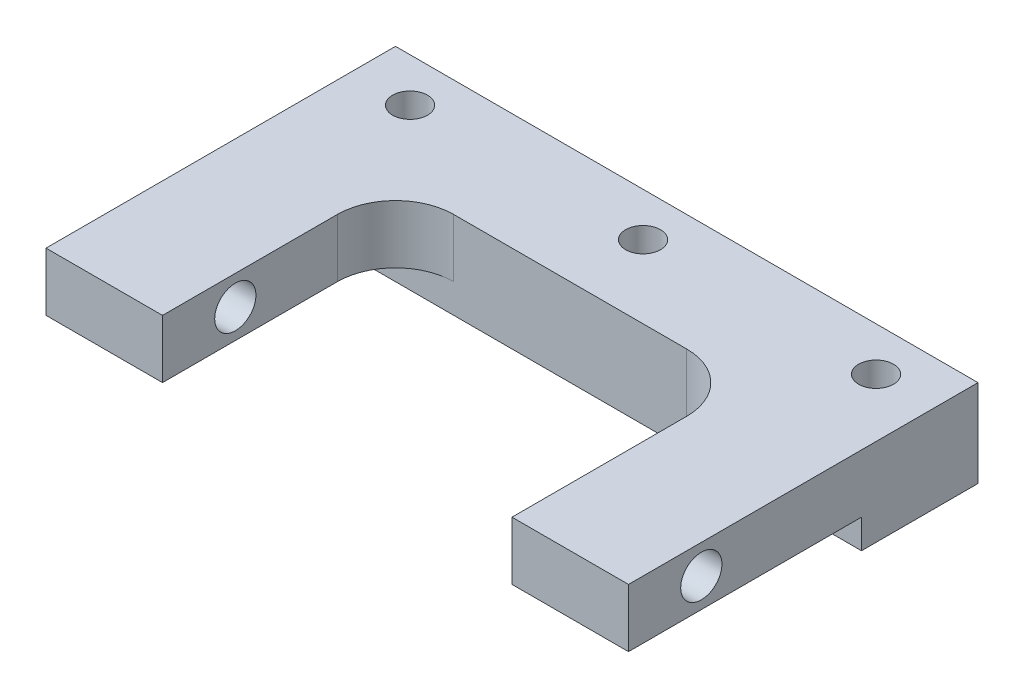
from build123d import *

# Parameters (mm, degrees)
SKETCH3_W                  = 63.5
SKETCH3_H                  = 9.525
BOSS_EXTRUDE1_DEPTH        = 12.7
TAP_DRILL_FOR_10_24_TAP1_D = 3.7973
SKETCH11_W                 = 12.7
SKETCH11_H                 = 6.35
BOSS_EXTRUDE2_DEPTH        = 25.4
F_8_CLEARANCE_HOLE2_D      = 4.4958
FILLET1_R                  = 6.35


with BuildPart() as part:
    # Sketch3 → Boss-Extrude1 (new body)
    with BuildSketch(Plane.XY):
        with Locations((31.75, 4.7625)):
            Rectangle(SKETCH3_W, SKETCH3_H)
    extrude(amount=BOSS_EXTRUDE1_DEPTH)

    # Tap Drill for #10-24 Tap1 (through all)
    with Locations(Plane(origin=(0, 9.525, 0), x_dir=(1, 0, 0), z_dir=(0, 1, 0))):
        with Locations((57.15, -4.7625), (6.35, -4.7625), (31.75, -4.7625)):
            Hole(TAP_DRILL_FOR_10_24_TAP1_D / 2)

    # Sketch11 → Boss-Extrude2 (add)
    with BuildSketch(Plane.XY.offset(12.7)):
        with Locations((6.35, 6.35)):
            Rectangle(SKETCH11_W, SKETCH11_H)
        with Locations((57.15, 6.35)):
            Rectangle(SKETCH11_W, SKETCH11_H)
    extrude(amount=BOSS_EXTRUDE2_DEPTH)

    # #8 Clearance Hole2 (through all)
    with Locations(Plane.ZY):
        with Locations((30.1625, 6.35)):
            Hole(F_8_CLEARANCE_HOLE2_D / 2)

    # Fillet1
    fillet1_edges = [part.edges().sort_by_distance(p)[0] for p in [
        (12.7, 6.35, 12.7),
        (50.8, 6.35, 12.7),
    ]]
    fillet(fillet1_edges, radius=FILLET1_R)


solid = part.part
